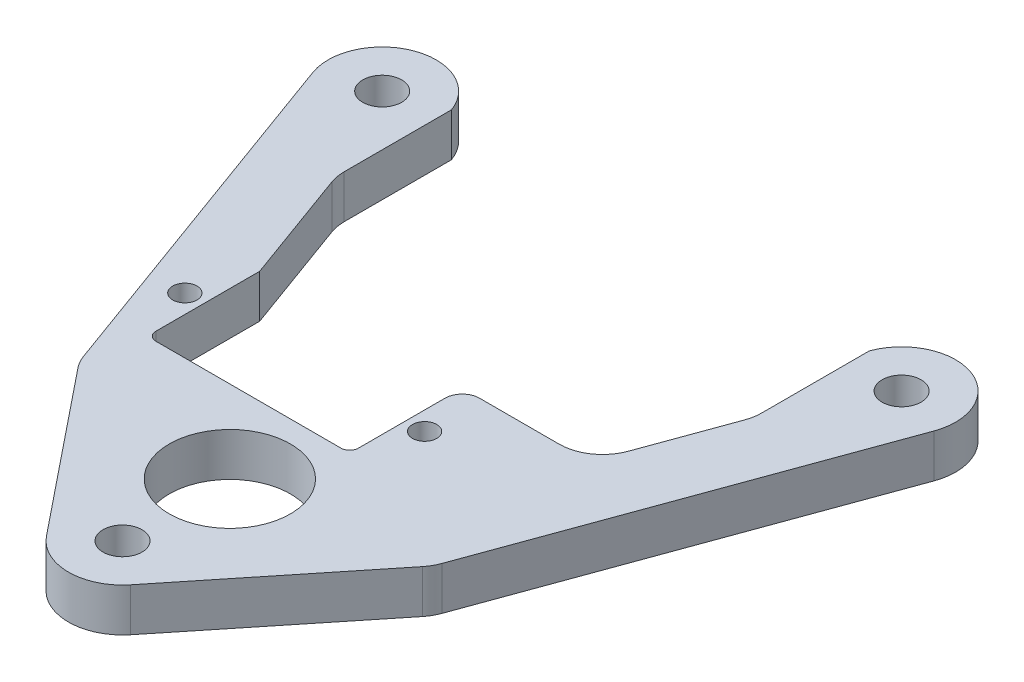
from build123d import *

# Parameters (mm, degrees)
SKETCH1_R               = 2.25
BOSS_EXTRUDE1_DEPTH     = 5
CUT_EXTRUDE1_DEPTH      = 53.646794774
CUT_EXTRUDE2_DEPTH      = 53.646794774
CUT_EXTRUDE2_DEPTH_BACK = 53.646794774
SKETCH4_R               = 1.4
SKETCH4_W               = 23.4
SKETCH4_H               = 13
FILLET1_R               = 5
FILLET2_R               = 1
FILLET3_R               = 2
SKETCH5_R               = 7
CUT_EXTRUDE3_DEPTH      = 53.646794774


with BuildPart() as part:
    # Sketch1 → Boss-Extrude1 (new body)
    with BuildSketch(Plane(origin=(0, 0, 0), x_dir=(1, 0, 0), z_dir=(0, 1, 0))):
        with BuildLine():
            Line((0, 9), (15.123161628, 9))
            Line((15.123161628, 9), (24.12692112, 33.737625896))
            ThreePointArc((24.12692112, 33.737625896), (32.137625896, 37.47307888), (35.87307888, 29.462374104))
            Line((35.87307888, 29.462374104), (20.41803863, -13))
            Line((20.41803863, -13), (4.868831591, -32.31879815))
            ThreePointArc((4.868831591, -32.31879815), (2.699074986, -34.037153024), (0, -34.65))
            Line((0, -34.65), (0, -30.65))
            ThreePointArc((0, -30.65), (2.25, -28.4), (0, -26.15))
            Line((0, -26.15), (0, -9))
            Line((0, -9), (0, 9))
        make_face()
        with Locations(Location((30, 31.6, 0), (0, 0, 270))):
            Circle(SKETCH1_R, mode=Mode.SUBTRACT)
    boss_extrude1 = extrude(amount=BOSS_EXTRUDE1_DEPTH)

    # Mirror1: Boss-Extrude1 across plane
    add(boss_extrude1.mirror(Plane(origin=(0, 0, 0), x_dir=(0, 0, 1), z_dir=(1, 0, 0))))

    # Sketch3 → Cut-Extrude1 (cut, symmetric)
    with BuildSketch(Plane(origin=(0, 5, 0), x_dir=(1, 0, 0), z_dir=(0, 1, 0))):
        Polygon((-15.123161628, 9), (-24.12692112, 33.737625896), (-24.12692112, 20.448726138), (-19.05, 6.5), (0, 6.5), (0, 9), align=None)
    cut_extrude1 = extrude(amount=CUT_EXTRUDE1_DEPTH, both=True, mode=Mode.SUBTRACT)

    # Mirror2: Cut-Extrude1 across plane
    add(cut_extrude1.mirror(Plane(origin=(0, 0, 0), x_dir=(0, 0, 1), z_dir=(1, 0, 0))), mode=Mode.SUBTRACT)

    # Sketch4 → Cut-Extrude2 (cut, two sides: drawn at the far end of the back side and taken through both)
    with BuildSketch(Plane(origin=(0, 5, 0), x_dir=(1, 0, 0), z_dir=(0, 1, 0)).offset(-CUT_EXTRUDE2_DEPTH_BACK)):
        with Locations(Location((6.5, 0, 0), (0, 0, 270))):
            Circle(SKETCH4_R)
        with Locations(Location((-21.2, 0, 0), (0, 0, 270))):
            Circle(SKETCH4_R)
        with Locations((-7.35, 0)):
            Rectangle(SKETCH4_W, SKETCH4_H)
    extrude(amount=CUT_EXTRUDE2_DEPTH + CUT_EXTRUDE2_DEPTH_BACK, mode=Mode.SUBTRACT)

    # Fillet1
    fillet1_edges = [part.edges().sort_by_distance(p)[0] for p in [
        (20.41803863, 2.5, 13),
        (-20.41803863, 2.5, 13),
        (-24.12692112, 2.5, -20.448726138),
        (19.05, 2.5, -6.5),
        (24.12692112, 2.5, -20.448726138),
    ]]
    fillet(fillet1_edges, radius=FILLET1_R)

    # Fillet2
    fillet2_edges = [part.edges().sort_by_distance(p)[0] for p in [
        (4.35, 2.5, 6.5),
        (-19.05, 2.5, 6.5),
    ]]
    fillet(fillet2_edges, radius=FILLET2_R)

    # Fillet3
    fillet3_edges = [part.edges().sort_by_distance(p)[0] for p in [
        (4.35, 2.5, -6.5),
    ]]
    fillet(fillet3_edges, radius=FILLET3_R)

    # Sketch5 → Cut-Extrude3 (cut, through all)
    with BuildSketch(Plane(origin=(0, 5, 0), x_dir=(1, 0, 0), z_dir=(0, 1, 0))):
        with Locations(Location((0, -16, 0), (0, 0, 270))):
            Circle(SKETCH5_R)
    extrude(amount=-CUT_EXTRUDE3_DEPTH, mode=Mode.SUBTRACT)


solid = part.part
